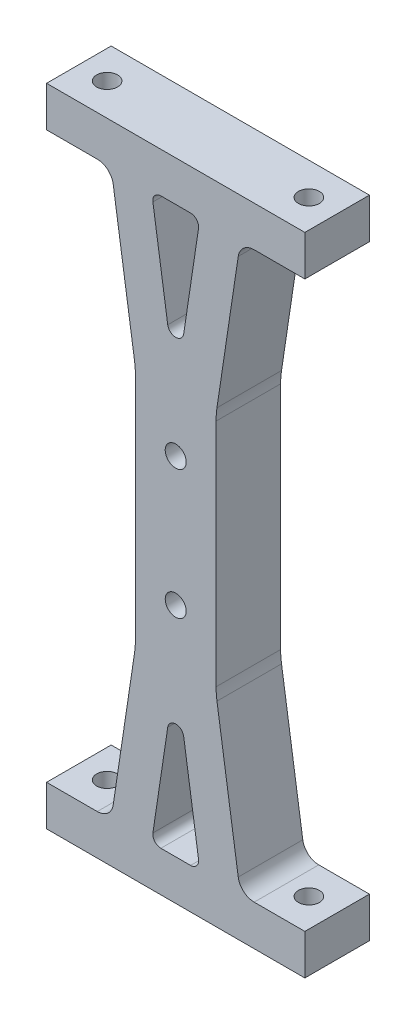
from build123d import *

# Parameters (mm, degrees)
BOSS_EXTRUDE1_DEPTH = 8
CUT_EXTRUDE1_REACH  = 62.515
SKETCH3_R           = 1.3
CUT_EXTRUDE2_DEPTH  = 84.004180545
FILLET6_R           = 2
FILLET7_R           = 1
FILLET8_R           = 10
CUT_EXTRUDE3_REACH  = 62.515
SKETCH4_R           = 1.3


with BuildPart() as part:
    # Sketch1 → Boss-Extrude1 (new body)
    with BuildSketch(Plane(origin=(0, 0, 0), x_dir=(0, 1, 0), z_dir=(0, 0, 1))):
        Polygon((-56.323529412, 20.632352941), (-56.323529412, -11.367647059), (-51.323529412, -11.367647059), (-51.323529412, -3.367647059), (-31.323529412, -0.367647059), (-1.323529412, -0.367647059), (18.676470588, -3.367647059), (18.676470588, -11.367647059), (23.676470588, -11.367647059), (23.676470588, 20.632352941), (18.676470588, 20.632352941), (18.676470588, 12.632352941), (-1.323529412, 9.632352941), (-31.323529412, 9.632352941), (-51.323529412, 12.632352941), (-51.323529412, 20.632352941), align=None)
    extrude(amount=BOSS_EXTRUDE1_DEPTH)

    # Sketch2 → Cut-Extrude1 (cut, up to next)
    with BuildSketch(Plane.XY.offset(8), mode=Mode.PRIVATE) as cut_extrude1_sk1:
        Polygon((-7.632352941, -51.323529412), (-4.632352941, -31.323529412), (-1.632352941, -51.323529412), align=None)
    cut_extrude1_tool1 = extrude(cut_extrude1_sk1.sketch, amount=-CUT_EXTRUDE1_REACH, mode=Mode.PRIVATE) & part.part
    # Sketch2 → Cut-Extrude1 (cut, up to next)
    with BuildSketch(Plane.XY.offset(8), mode=Mode.PRIVATE) as cut_extrude1_sk2:
        Polygon((-1.632352941, 18.676470588), (-7.632352941, 18.676470588), (-4.632352941, -1.323529412), align=None)
    cut_extrude1_tool2 = extrude(cut_extrude1_sk2.sketch, amount=-CUT_EXTRUDE1_REACH, mode=Mode.PRIVATE) & part.part
    add(cut_extrude1_tool1.solids().sort_by_distance((-4.632353, -44.656863, 8))[0], mode=Mode.SUBTRACT)
    add(cut_extrude1_tool2.solids().sort_by_distance((-4.632353, 12.009804, 8))[0], mode=Mode.SUBTRACT)

    # Sketch3 → Cut-Extrude2 (cut, through all)
    with BuildSketch(Plane.XZ.offset(56.323529412)):
        with Locations(Location((-17.132352941, 4, 0), (0, 0, 270))):
            Circle(SKETCH3_R)
        with Locations(Location((7.867647059, 4, 0), (0, 0, 270))):
            Circle(SKETCH3_R)
    extrude(amount=-CUT_EXTRUDE2_DEPTH, mode=Mode.SUBTRACT)

    # Fillet6
    fillet6_edges = [part.edges().sort_by_distance(p)[0] for p in [
        (-12.632352941, -51.323529412, 4),
        (-12.632352941, 18.676470588, 4),
        (3.367647059, 18.676470588, 4),
        (3.367647059, -51.323529412, 4),
    ]]
    fillet(fillet6_edges, radius=FILLET6_R)

    # Fillet7
    fillet7_edges = [part.edges().sort_by_distance(p)[0] for p in [
        (-1.632352941, -51.323529412, 4),
        (-7.632352941, -51.323529412, 4),
        (-4.632352941, -31.323529412, 4),
        (-1.632352941, 18.676470588, 4),
        (-4.632352941, -1.323529412, 4),
        (-7.632352941, 18.676470588, 4),
    ]]
    fillet(fillet7_edges, radius=FILLET7_R)

    # Fillet8
    fillet8_edges = [part.edges().sort_by_distance(p)[0] for p in [
        (-9.632352941, -31.323529412, 4),
        (-9.632352941, -1.323529412, 4),
        (0.367647059, -1.323529412, 4),
        (0.367647059, -31.323529412, 4),
    ]]
    fillet(fillet8_edges, radius=FILLET8_R)

    # Sketch4 → Cut-Extrude3 (cut, up to next)
    with BuildSketch(Plane.XY.offset(8), mode=Mode.PRIVATE) as cut_extrude3_sk1:
        with Locations((-4.632352941, -8.323529412)):
            Circle(SKETCH4_R)
    cut_extrude3_tool1 = extrude(cut_extrude3_sk1.sketch, amount=-CUT_EXTRUDE3_REACH, mode=Mode.PRIVATE) & part.part
    # Sketch4 → Cut-Extrude3 (cut, up to next)
    with BuildSketch(Plane.XY.offset(8), mode=Mode.PRIVATE) as cut_extrude3_sk2:
        with Locations((-4.632352941, -24.323529412)):
            Circle(SKETCH4_R)
    cut_extrude3_tool2 = extrude(cut_extrude3_sk2.sketch, amount=-CUT_EXTRUDE3_REACH, mode=Mode.PRIVATE) & part.part
    add(cut_extrude3_tool1.solids().sort_by_distance((-4.632353, -8.323529, 8))[0], mode=Mode.SUBTRACT)
    add(cut_extrude3_tool2.solids().sort_by_distance((-4.632353, -24.323529, 8))[0], mode=Mode.SUBTRACT)


solid = part.part
